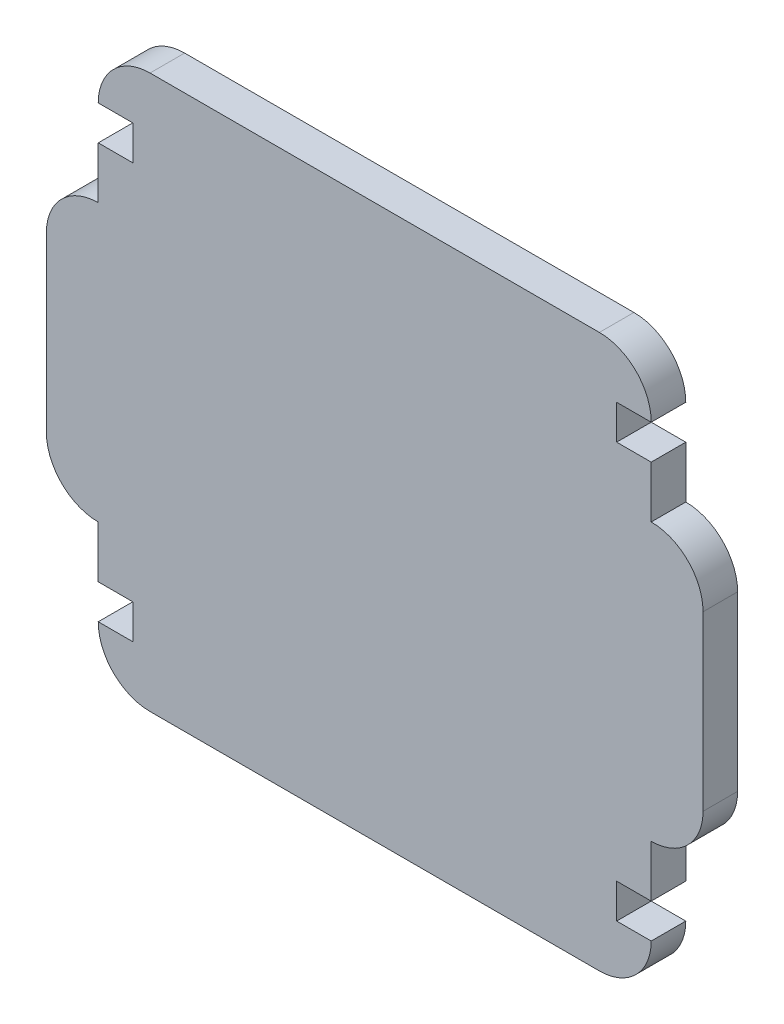
from build123d import *

# Parameters (mm, degrees)
BOSS_EXTRUDE2_DEPTH = 3.175


with BuildPart() as part:
    # Sketch1 → Boss-Extrude2 (new body)
    with BuildSketch(Plane.XY):
        with BuildLine():
            ThreePointArc((-25.4, -12.7), (-28.767596045, -11.305096045), (-30.1625, -7.9375))
            Line((-30.1625, -7.9375), (-30.1625, 7.9375))
            ThreePointArc((-30.1625, 7.9375), (-28.767596045, 11.305096045), (-25.4, 12.7))
            Line((-25.4, 12.7), (-25.4, 17.4625))
            Line((-25.4, 17.4625), (-22.225, 17.4625))
            Line((-22.225, 17.4625), (-22.225, 20.6375))
            Line((-22.225, 20.6375), (-25.4, 20.6375))
            ThreePointArc((-25.4, 20.6375), (-24.005096045, 24.005096045), (-20.6375, 25.4))
            Line((-20.6375, 25.4), (20.6375, 25.4))
            ThreePointArc((20.6375, 25.4), (24.005096045, 24.005096045), (25.4, 20.6375))
            Line((25.4, 20.6375), (22.225, 20.6375))
            Line((22.225, 20.6375), (22.225, 17.4625))
            Line((22.225, 17.4625), (25.4, 17.4625))
            Line((25.4, 17.4625), (25.4, 12.7))
            ThreePointArc((25.4, 12.7), (28.767596045, 11.305096045), (30.1625, 7.9375))
            Line((30.1625, 7.9375), (30.1625, -7.9375))
            ThreePointArc((30.1625, -7.9375), (28.767596045, -11.305096045), (25.4, -12.7))
            Line((25.4, -12.7), (25.4, -17.4625))
            Line((25.4, -17.4625), (22.225, -17.4625))
            Line((22.225, -17.4625), (22.225, -20.6375))
            Line((22.225, -20.6375), (25.4, -20.6375))
            ThreePointArc((25.4, -20.6375), (24.005096045, -24.005096045), (20.6375, -25.4))
            Line((20.6375, -25.4), (-20.6375, -25.4))
            ThreePointArc((-20.6375, -25.4), (-24.005096045, -24.005096045), (-25.4, -20.6375))
            Line((-25.4, -20.6375), (-22.225, -20.6375))
            Line((-22.225, -20.6375), (-22.225, -17.4625))
            Line((-22.225, -17.4625), (-25.4, -17.4625))
            Line((-25.4, -17.4625), (-25.4, -12.7))
        make_face()
    extrude(amount=BOSS_EXTRUDE2_DEPTH)


solid = part.part
